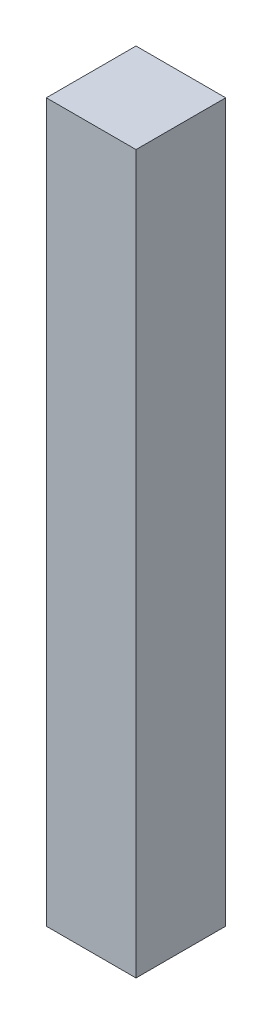
from build123d import *

# Parameters (mm, degrees)
SKETCH_1_W      = 50
SKETCH_1_H      = 400
EXTRUDE_1_DEPTH = 50


with BuildPart() as part:
    # 草图1 → 凸台-拉伸1 (new body)
    with BuildSketch(Plane.XY):
        Rectangle(SKETCH_1_W, SKETCH_1_H)
    extrude(amount=EXTRUDE_1_DEPTH)


solid = part.part
